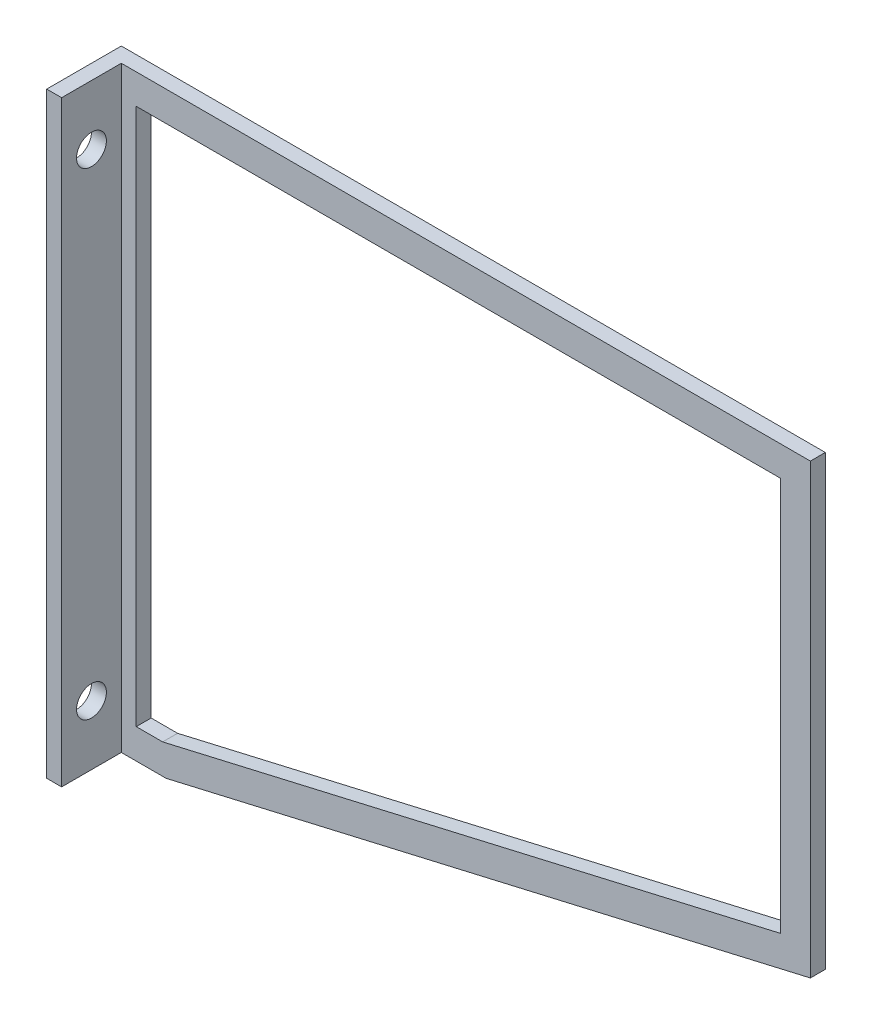
from build123d import *

# Parameters (mm, degrees)
BOSS_EXTRUDE1_DEPTH = 5
SKETCH2_W           = 5
SKETCH2_H           = 200
BOSS_EXTRUDE2_DEPTH = 20
SKETCH3_R           = 5
CUT_EXTRUDE1_DEPTH  = 307.481412279


with BuildPart() as part:
    # Sketch1 → Boss-Extrude1 (new body)
    with BuildSketch(Plane.XY):
        Polygon((0, 0), (20, 0), (235.880609996, 50), (235.880609996, 200), (0, 200), align=None)
        Polygon((10, 190), (225.880609996, 190), (225.880609996, 57.948616206), (18.857079694, 10), (10, 10), align=None, mode=Mode.SUBTRACT)
    extrude(amount=BOSS_EXTRUDE1_DEPTH)

    # Sketch2 → Boss-Extrude2 (add)
    with BuildSketch(Plane.XY.offset(5)):
        with Locations((2.5, 100)):
            Rectangle(SKETCH2_W, SKETCH2_H)
    extrude(amount=BOSS_EXTRUDE2_DEPTH)

    # Sketch3 → Cut-Extrude1 (cut, through all)
    with BuildSketch(Plane(origin=(5, 0, 0), x_dir=(0, 0, -1), z_dir=(1, 0, 0))):
        with Locations(Location((-15, 180, 0), (0, 0, 90))):
            Circle(SKETCH3_R)
        with Locations(Location((-15, 20, 0), (0, 0, 90))):
            Circle(SKETCH3_R)
    extrude(amount=-CUT_EXTRUDE1_DEPTH, mode=Mode.SUBTRACT)


solid = part.part
